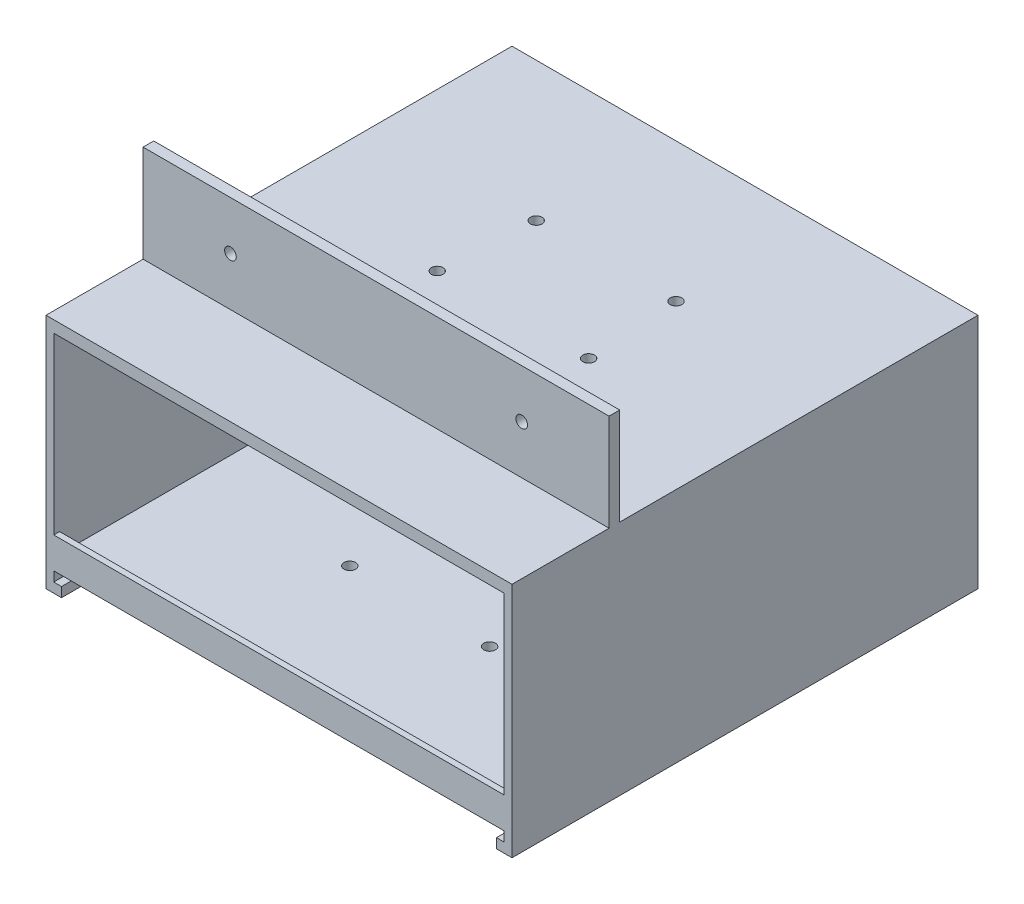
from build123d import *

# Parameters (mm, degrees)
SKETCH_2_W          = 120
SKETCH_2_H          = 120
EXTRUDE_1_DEPTH     = 3
SKETCH_5_W          = 2
SKETCH_5_H          = 120
EXTRUDE_3_DEPTH     = 50
SKETCH_6_W          = 120
SKETCH_6_H          = 120
EXTRUDE_4_DEPTH     = 3
SKETCH_7_W          = 116
SKETCH_7_H          = 1.5
EXTRUDE_5_DEPTH     = 5
SKETCH_9_W          = 120
SKETCH_9_H          = 2.735218368
EXTRUDE_6_DEPTH     = 25
SKETCH_11_R         = 1.5
CUT_EXTRUDE_1_DEPTH = 58
SKETCH_10_R         = 1.5
CUT_EXTRUDE_2_DEPTH = 3
SKETCH_13_W         = 4
SKETCH_13_H         = 120
EXTRUDE_10_DEPTH    = 5
SKETCH_14_W         = 2
SKETCH_14_H         = 2.5
CUT_EXTRUDE_3_DEPTH = 120


with BuildPart() as part:
    # 草图2 → 凸台-拉伸1 (new body)
    with BuildSketch(Plane(origin=(0, 0, 0), x_dir=(1, 0, 0), z_dir=(0, 1, 0))):
        with Locations((60, -60)):
            Rectangle(SKETCH_2_W, SKETCH_2_H)
    extrude(amount=EXTRUDE_1_DEPTH)

    # 草图5 → 凸台-拉伸3 (add)
    with BuildSketch(Plane(origin=(0, 3, 0), x_dir=(1, 0, 0), z_dir=(0, 1, 0))):
        with Locations((1, -60)):
            Rectangle(SKETCH_5_W, SKETCH_5_H)
        with Locations((119, -60)):
            Rectangle(SKETCH_5_W, SKETCH_5_H)
    extrude(amount=EXTRUDE_3_DEPTH)

    # 草图6 → 凸台-拉伸4 (add)
    with BuildSketch(Plane(origin=(0, 53, 0), x_dir=(1, 0, 0), z_dir=(0, 1, 0))):
        with Locations((60, -60)):
            Rectangle(SKETCH_6_W, SKETCH_6_H)
    extrude(amount=EXTRUDE_4_DEPTH)

    # 草图7 → 凸台-拉伸5 (add)
    with BuildSketch(Plane(origin=(0, 3, 0), x_dir=(1, 0, 0), z_dir=(0, 1, 0))):
        with Locations((60, -119.25)):
            Rectangle(SKETCH_7_W, SKETCH_7_H)
    extrude(amount=EXTRUDE_5_DEPTH)

    # 草图9 → 凸台-拉伸6 (add)
    with BuildSketch(Plane(origin=(0, 56, 0), x_dir=(1, 0, 0), z_dir=(0, 1, 0))):
        with Locations((60, -93.632390816)):
            Rectangle(SKETCH_9_W, SKETCH_9_H)
    extrude(amount=EXTRUDE_6_DEPTH)

    # 草图11 → 切除-拉伸1 (cut)
    with BuildSketch(Plane(origin=(0, 56, 0), x_dir=(1, 0, 0), z_dir=(0, 1, 0))):
        with Locations(Location((42, -35.764781632, 0), (0, 0, 270))):
            Circle(SKETCH_11_R)
        with Locations(Location((40.5, -59.764781632, 0), (0, 0, 270))):
            Circle(SKETCH_11_R)
        with Locations(Location((42, -83.764781632, 0), (0, 0, 270))):
            Circle(SKETCH_11_R)
        with Locations(Location((79.5, -59.764781632, 0), (0, 0, 270))):
            Circle(SKETCH_11_R)
        with Locations(Location((78, -83.764781632, 0), (0, 0, 270))):
            Circle(SKETCH_11_R)
        with Locations(Location((78, -35.764781632, 0), (0, 0, 270))):
            Circle(SKETCH_11_R)
    extrude(amount=-CUT_EXTRUDE_1_DEPTH, mode=Mode.SUBTRACT)

    # 草图10 → 切除-拉伸2 (cut)
    with BuildSketch(Plane.XY.offset(95)):
        with Locations((22.5, 68.5)):
            Circle(SKETCH_10_R)
        with Locations((97.5, 68.5)):
            Circle(SKETCH_10_R)
    extrude(amount=-CUT_EXTRUDE_2_DEPTH, mode=Mode.SUBTRACT)

    # 草图13 → 凸台-拉伸10 (add)
    with BuildSketch(Plane(origin=(0, 0, 0), x_dir=(-1, 0, 0), z_dir=(0, -1, 0))):
        with Locations((-2, -60)):
            Rectangle(SKETCH_13_W, SKETCH_13_H)
        with Locations((-118, -60)):
            Rectangle(SKETCH_13_W, SKETCH_13_H)
    extrude(amount=EXTRUDE_10_DEPTH)

    # 草图14 → 切除-拉伸3 (cut)
    with BuildSketch(Plane(origin=(0, 0, 0), x_dir=(-1, 0, 0), z_dir=(0, 0, -1))):
        with Locations((-117, -1.25)):
            Rectangle(SKETCH_14_W, SKETCH_14_H)
        with Locations((-3, -1.25)):
            Rectangle(SKETCH_14_W, SKETCH_14_H)
    extrude(amount=-CUT_EXTRUDE_3_DEPTH, mode=Mode.SUBTRACT)


solid = part.part
